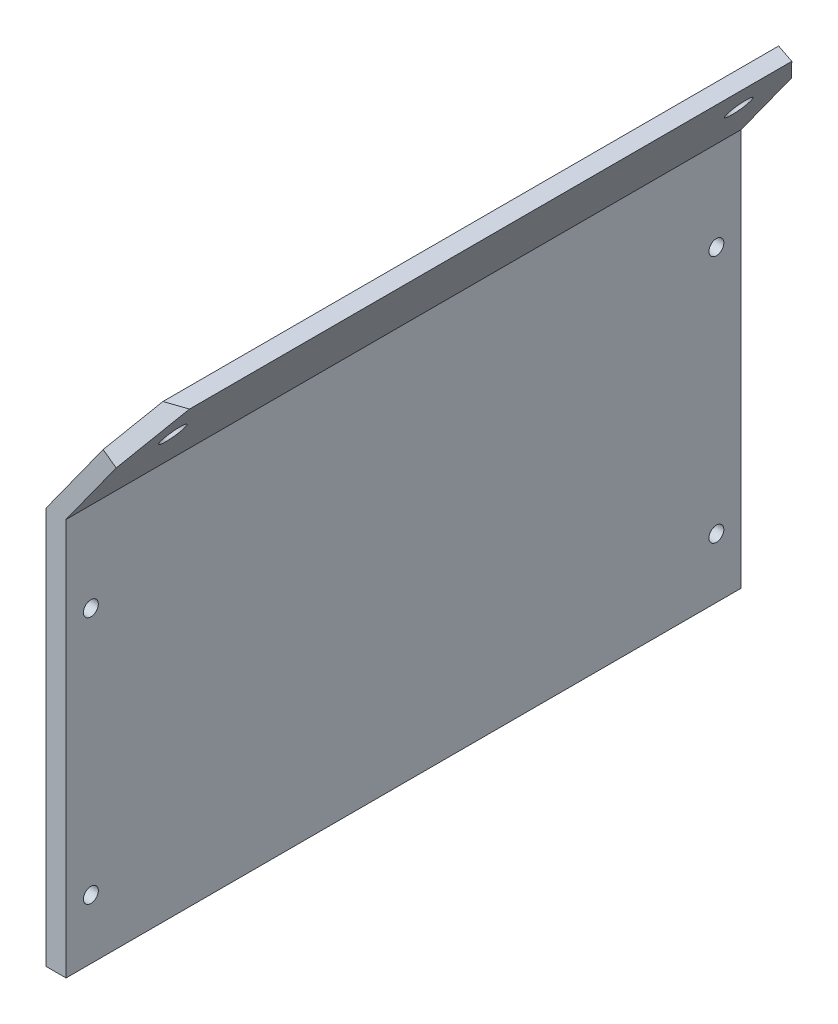
from build123d import *

# Parameters (mm, degrees)
EXTRUDE_1_DEPTH     = 136
SKETCH_3_R          = 1.5
CUT_EXTRUDE_1_DEPTH = 136
SKETCH_4_R          = 2.5
CUT_EXTRUDE_2_DEPTH = 136
CUT_EXTRUDE_3_DEPTH = 136


with BuildPart() as part:
    # 草图2 → 凸台-拉伸1 (new body)
    with BuildSketch(Plane.XY):
        Polygon((-38.864866985, -21.515849201), (-38.864866985, 58.484150799), (-21.335725209, 82.830181043), (-17.335725209, 82.830181043), (-34.864866985, 58.484150799), (-34.864866985, -21.515849201), align=None)
    extrude(amount=EXTRUDE_1_DEPTH)

    # 草图3 → 切除-拉伸1 (cut)
    with BuildSketch(Plane(origin=(-34.864866985, 0, 0), x_dir=(0, 0, -1), z_dir=(1, 0, 0))):
        with Locations(Location((-131, 40.484150799, 0), (0, 0, 90))):
            Circle(SKETCH_3_R)
        with Locations(Location((-131, -9.515849201, 0), (0, 0, 90))):
            Circle(SKETCH_3_R)
        with Locations(Location((-5, 40.484150799, 0), (0, 0, 90))):
            Circle(SKETCH_3_R)
        with Locations(Location((-5, -9.515849201, 0), (0, 0, 90))):
            Circle(SKETCH_3_R)
    extrude(amount=-CUT_EXTRUDE_1_DEPTH, mode=Mode.SUBTRACT)

    # 草图4 → 切除-拉伸2 (cut)
    with BuildSketch(Plane(origin=(-50.693793177, 36.499531087, 0), x_dir=(0, 0, -1), z_dir=(0.8115343414514944, -0.5843047258450759, 0))):
        with Locations(Location((-125, 45.090190259, 0), (0, 0, 90))):
            Circle(SKETCH_4_R)
        with Locations(Location((-11, 45.090190259, 0), (0, 0, 90))):
            Circle(SKETCH_4_R)
    extrude(amount=-CUT_EXTRUDE_2_DEPTH, mode=Mode.SUBTRACT)

    # 草图5 → 切除-拉伸3 (cut)
    with BuildSketch(Plane(origin=(-50.693793177, 36.499531087, 0), x_dir=(0, 0, -1), z_dir=(0.8115343414514944, -0.5843047258450759, 0))):
        Polygon((-136, 44.378333204), (-136, 60.422396469), (-128.660805907, 57.090190259), align=None)
        Polygon((-7.339194093, 57.090190259), (0, 57.090190259), (0, 44.378333204), align=None)
    extrude(amount=-CUT_EXTRUDE_3_DEPTH, mode=Mode.SUBTRACT)


solid = part.part
